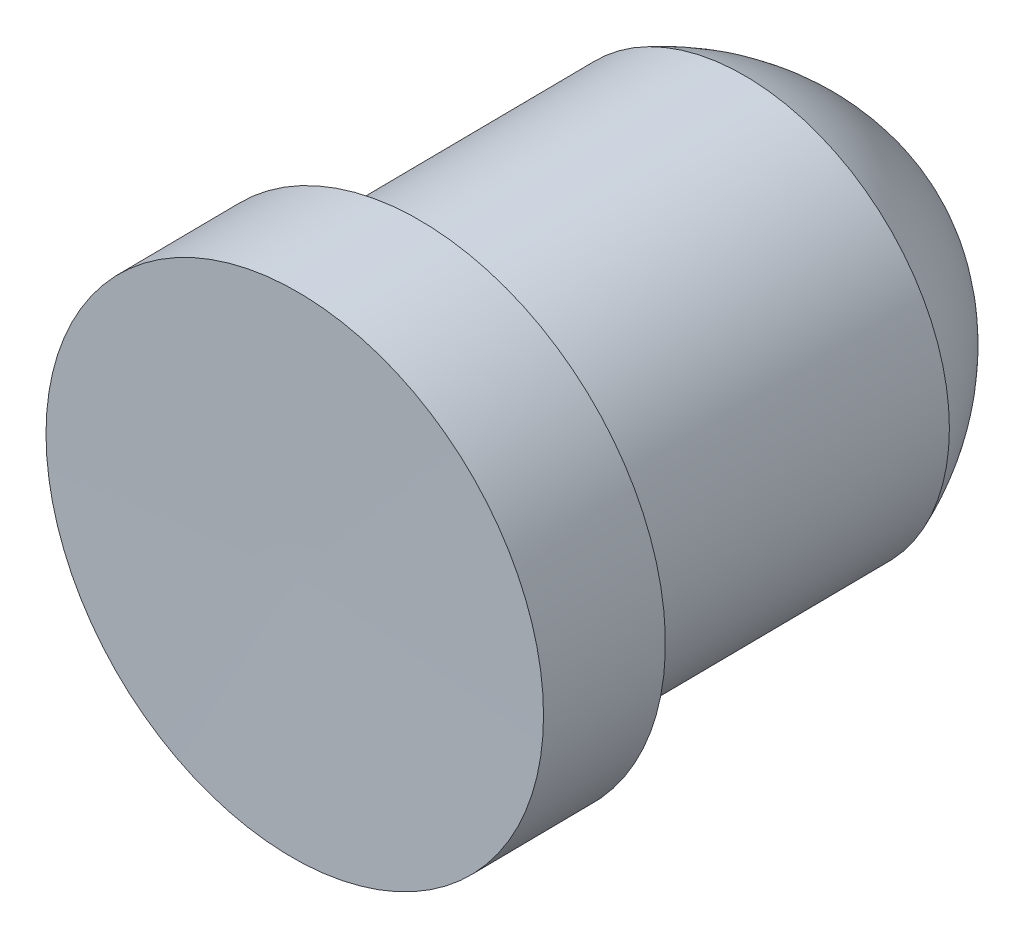
from build123d import *


with BuildPart() as part:
    # Sketch3 → Revolve1 (revolve)
    with BuildSketch(Plane(origin=(0, 0, 0), x_dir=(1, 0, 0), z_dir=(0, 1, 0)), mode=Mode.PRIVATE) as revolve1_sk:
        with BuildLine():
            Line((2.810525664, 28.046301015), (5.810694887, 28.04495753))
            Line((5.810694887, 28.04495753), (5.79542003, 29.54496452))
            Line((5.79542003, 29.54496452), (5.295391827, 29.545188435))
            Line((5.295391827, 29.545188435), (5.254661178, 33.544981056))
            ThreePointArc((5.254661178, 33.544981056), (4.253623004, 34.861224767), (2.734475594, 35.514498125))
            Line((2.734475594, 35.514498125), (2.810525664, 28.046301015))
        make_face()
    revolve(revolve1_sk.sketch.rotate(Axis((2.702632129, 0, -38.641559941), (0.010182662021554233, 0, 0.9999481553531437)), 180), axis=Axis((2.702632129, 0, -38.641559941), (0.010182662021554233, 0, 0.9999481553531437)))


solid = part.part
